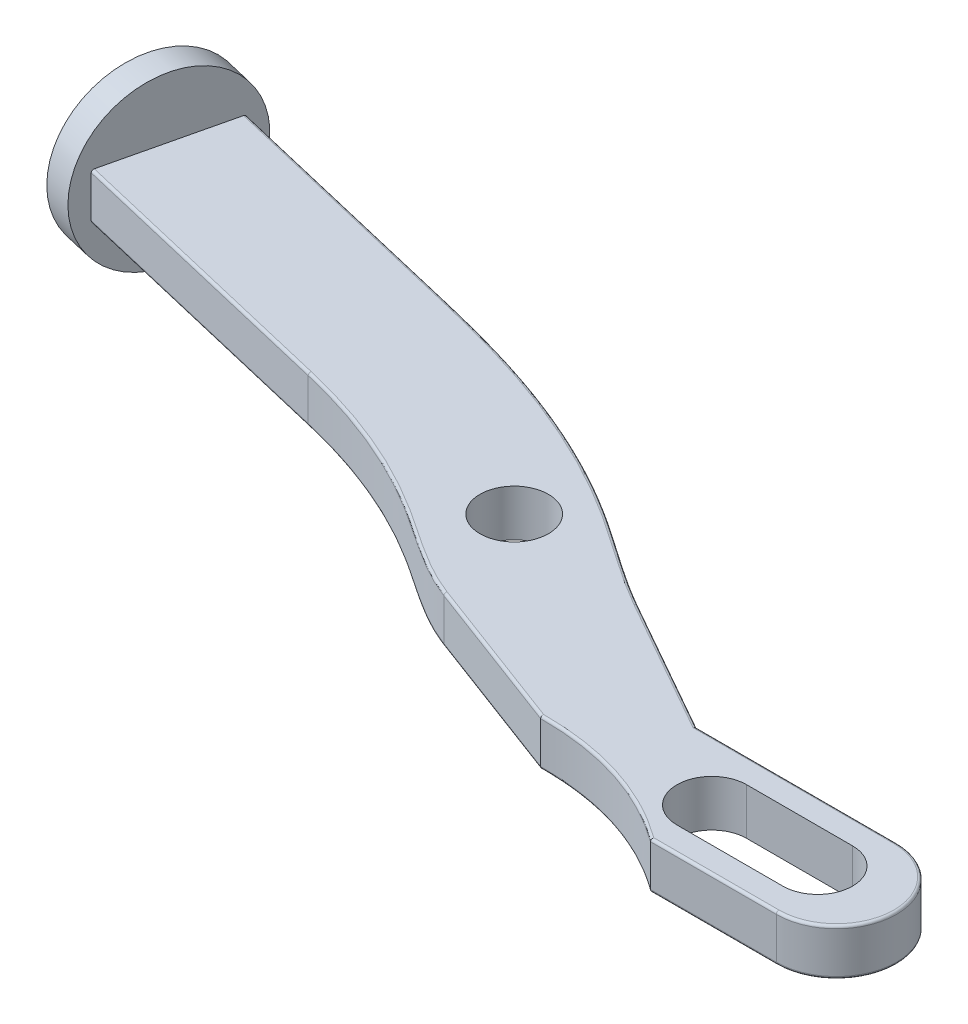
from build123d import *

# Parameters (mm, degrees)
SKETCH_1_R      = 2.65
EXTRUDE_1_DEPTH = 1.8
SKETCH_4_R      = 6.5
EXTRUDE_2_DEPTH = 2.2
FILLET_1_R      = 0.2


with BuildPart() as part:
    # Эскиз1 → Бобышка-Вытянуть1 (new, symmetric)
    with BuildSketch(Plane(origin=(0, 0, 0), x_dir=(1, 0, 0), z_dir=(0, 1, 0))):
        with BuildLine():
            Line((0, 0), (-9.75, 0))
            add(Edge.make_bspline(
                [(-22.25, 4), (-15.296798857, 4.030038289), (-9.75, 0)],
                knots=[0, 0, 0, 1, 1, 1], degree=2))
            Line((-22.25, 4), (-34.25, 8.5))
            add(Edge.make_bspline(
                [(-54.25, 18), (-49.273096964, 16.823641101), (-42.69144993, 14.029585327), (-36.752072816, 9.438277306), (-34.25, 8.5)],
                knots=[0, 0, 0, 0, 0.645146277, 1, 1, 1, 1], degree=3))
            Line((-54.25, 18), (-76.25, 23.2))
            Line((-76.25, 23.2), (-73.949745461, 32.931846128))
            Line((-73.949745461, 32.931846128), (-53.949745461, 28.2045734))
            add(Edge.make_bspline(
                [(-53.949745461, 28.2045734), (-51.225020143, 27.560547416), (-44.046103857, 25.680126804), (-34.543464428, 21.322196006), (-28.505950684, 16.660004334), (-26, 15.241899011)],
                knots=[0, 0, 0, 0, 0.269807929, 0.718748442, 1, 1, 1, 1], degree=3))
            Line((-26, 15.241899011), (-15.5, 9.3))
            Line((-15.5, 9.3), (0, 9.3))
            ThreePointArc((0, 9.3), (4.65, 4.65), (0, 0))
        make_face()
        with Locations(Location((-36.8, 16.5, 0), (0, 0, 270))):
            Circle(SKETCH_1_R, mode=Mode.SUBTRACT)
        with BuildLine():
            Line((-1.45, 1.95), (-9.65, 1.95))
            ThreePointArc((-9.65, 1.95), (-12.35, 4.65), (-9.65, 7.35))
            Line((-9.65, 7.35), (-1.45, 7.35))
            ThreePointArc((-1.45, 7.35), (1.25, 4.65), (-1.45, 1.95))
        make_face(mode=Mode.SUBTRACT)
    extrude(amount=EXTRUDE_1_DEPTH, both=True)

    # Эскиз4 → Бобышка-Вытянуть2 (add)
    with BuildSketch(Plane(origin=(-77.408969944, 0, -18.296665623), x_dir=(-0.2300254539289697, 0, 0.9731846127764102), z_dir=(-0.9731846127764103, 0, -0.23002545392896973))):
        with Locations((-10.038442154, 0)):
            Circle(SKETCH_4_R)
    extrude(amount=EXTRUDE_2_DEPTH)

    # Скругление1
    fillet_1_edges = [part.edges().sort_by_distance(p)[0] for p in [
        (-20.75, 1.8, -12.270949505),
        (-4.875, -1.8, 0),
        (-15.672091437, -1.8, -3.022584392),
        (-28.25, -1.8, -6.25),
        (-43.846066751, -1.8, -14.115535877),
        (-65.25, -1.8, -20.6),
        (-63.949745461, -1.8, -30.568209764),
        (-39.242509002, -1.8, -23.316914453),
        (-39.242509002, 1.8, -23.316914453),
        (-20.75, -1.8, -12.270949505),
        (-7.75, -1.8, -9.3),
        (4.65, -1.8, -4.65),
        (-63.949745461, 1.8, -30.568209764),
        (-65.25, 1.8, -20.6),
        (-43.846066751, 1.8, -14.115535877),
        (-28.25, 1.8, -6.25),
        (-15.672091437, 1.8, -3.022584392),
        (-4.875, 1.8, 0),
        (4.65, 1.8, -4.65),
        (-7.75, 1.8, -9.3),
    ]]
    fillet(fillet_1_edges, radius=FILLET_1_R)


solid = part.part
